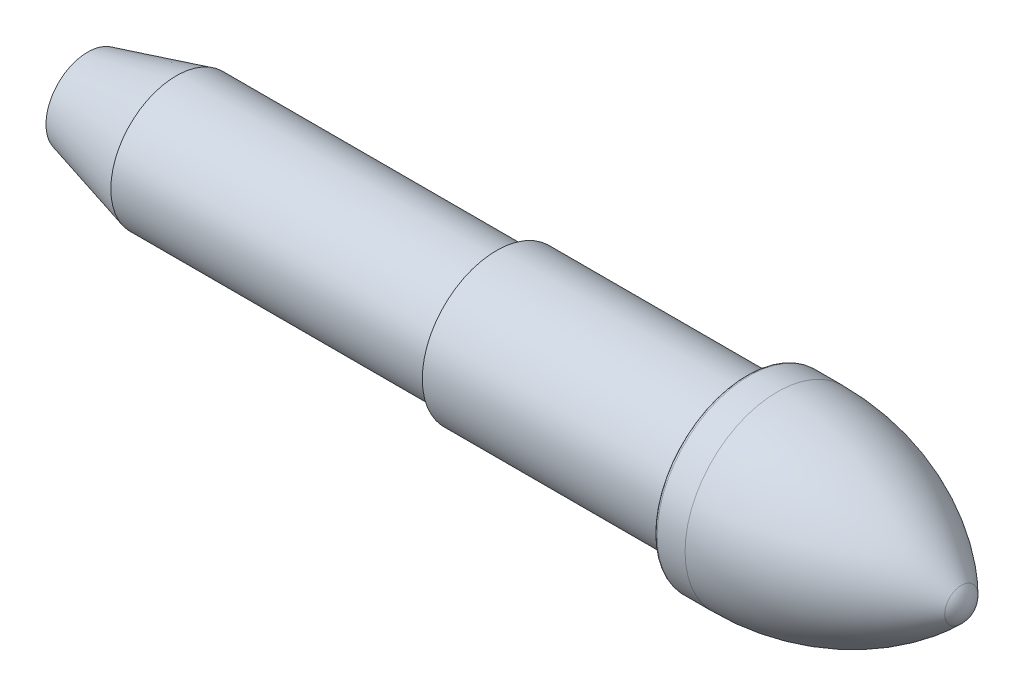
from build123d import *

# Parameters (mm, degrees)
FILLET1_R = 0.1


with BuildPart() as part:
    # Sketch1 → Base-Revolve (revolve)
    with BuildSketch(Plane.XY, mode=Mode.PRIVATE) as base_revolve_sk:
        with BuildLine():
            Line((0, 0), (0, 1.335))
            Line((0, 1.335), (2.836358614, 2.095))
            Line((2.836358614, 2.095), (13.09, 2.095))
            Line((13.09, 2.095), (13.09, 2.375))
            Line((13.09, 2.375), (21.09, 2.375))
            Line((21.09, 2.375), (21.09, 2.955))
            Line((21.09, 2.955), (22.084715758, 2.955))
            ThreePointArc((22.084715758, 2.955), (25.270167636, 2.325954543), (27.977387049, 0.533256881))
            ThreePointArc((27.977387049, 0.533256881), (28.142112811, 0.288928809), (28.2, 0))
            Line((28.2, 0), (0, 0))
        make_face()
    revolve(base_revolve_sk.sketch.rotate(Axis((0, 0, 0), (1, 0, 0)), 90), axis=Axis((0, 0, 0), (1, 0, 0)))

    # Fillet1
    fillet1_edges = [part.edges().sort_by_distance(p)[0] for p in [
        (21.09, 0, -2.955),
    ]]
    fillet(fillet1_edges, radius=FILLET1_R)


solid = part.part
